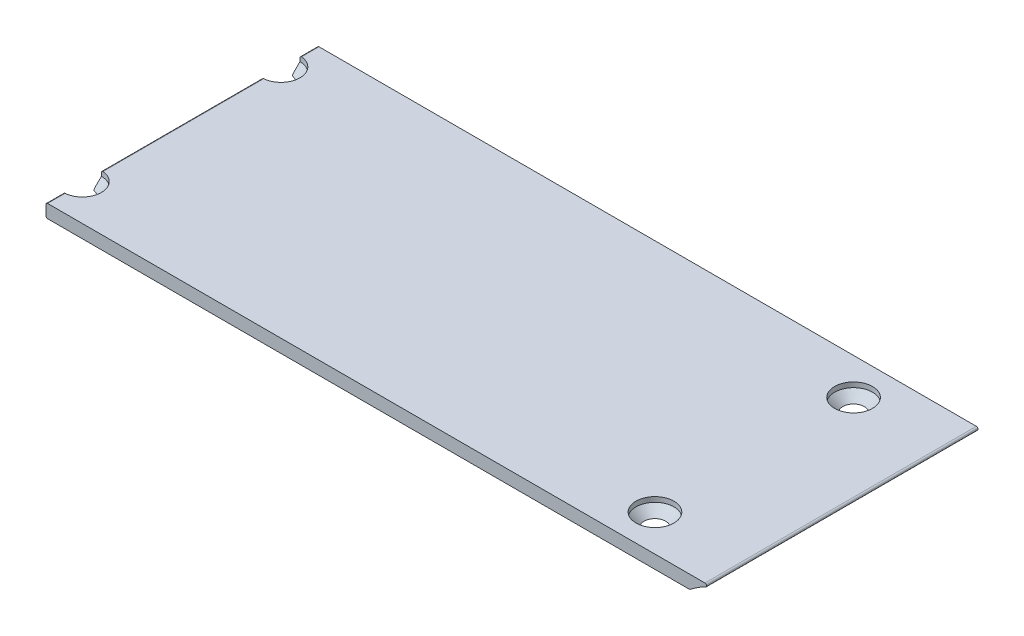
from build123d import *

# Parameters (mm, degrees)
AUFSATZ_LINEAR_START                        = -8.5
AUFSATZ_LINEAR_AUSTRAGEN1_DEPTH             = 41
VERRUNDUNG1_R                               = 0.5
FORMSENKUNG_F_R_M5_SENKSCHRAUBE_MIT_2_COUNT = 2
FORMSENKUNG_F_R_M5_SENKSCHRAUBE_MIT_2_PITCH = 173


with BuildPart() as part:
    # Skizze1 → Aufsatz-Linear austragen1 (new body)
    with BuildSketch(Plane.XY.offset(AUFSATZ_LINEAR_START)):
        with BuildLine():
            Line((225, 23), (426.559028492, 23))
            ThreePointArc((426.559028492, 23), (422.879511457, 21.29187069), (419.532291702, 19))
            Line((419.532291702, 19), (417.992648648, 19))
            Line((417.992648648, 19), (225, 19))
            Line((225, 19), (225, 23))
        make_face()
    extrude(amount=-AUFSATZ_LINEAR_AUSTRAGEN1_DEPTH)

    # Verrundung1
    verrundung1_edges = [part.edges().sort_by_distance(p)[0] for p in [
        (225, 23, -29),
        (426.559028492, 23, -29),
        (419.532291702, 19, -29),
        (225, 19, -29),
    ]]
    fillet(verrundung1_edges, radius=VERRUNDUNG1_R)

    # Skizze5 → Formsenkung für M5 Senkschraube mit Innensechskant1 (revolve, cut)
    with BuildSketch(Plane(origin=(398, 23, -19.5), x_dir=(0, 0, 1), z_dir=(1, 0, 0))):
        Polygon((0, 0), (0, 5.652366702), (2.75, 4), (2.75, 4.485), (5.735, 1.5), (5.735, 0), align=None)
    formsenkung_f_r_m5_senkschraube_mit_inne = revolve(axis=Axis((398, 29.35, -19.5), (0, -1, 0)), mode=Mode.SUBTRACT)

    # Formsenkung f_r M5 Senkschraube mit  2: Formsenkung für M5 Senkschraube mit Innensechskant1 ×2
    with Locations(*[(-i * FORMSENKUNG_F_R_M5_SENKSCHRAUBE_MIT_2_PITCH, 0, 0) for i in range(1, FORMSENKUNG_F_R_M5_SENKSCHRAUBE_MIT_2_COUNT)]):
        add(formsenkung_f_r_m5_senkschraube_mit_inne, mode=Mode.SUBTRACT)

    # Spiegeln1: part across plane


with BuildPart() as part_1:
    add(part.part)
    add(part.part.mirror(Plane(origin=(435, 0, -49.5), x_dir=(1, 0, 0), z_dir=(0, 0, 1))))


solid = part_1.part
